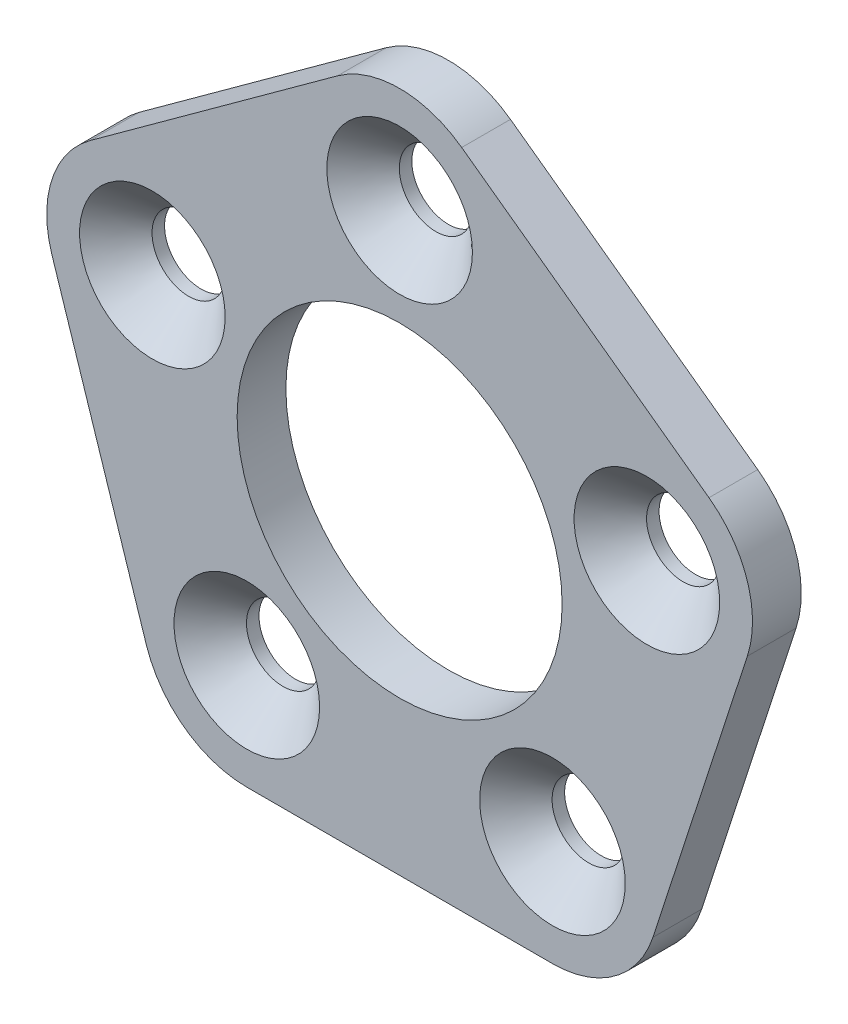
from build123d import *

# Parameters (mm, degrees)
SKETCH1_R                     = 10
BOSS_EXTRUDE1_DEPTH           = 3
CSK_FOR_M4_SFHCS1_D           = 4.5
CSK_FOR_M4_SFHCS1_DEPTH       = 5.1
CSK_FOR_M4_SFHCS1_CSINK_D     = 8.96
CSK_FOR_M4_SFHCS1_CSINK_ANGLE = 90
CSK_FOR_M4_SFHCS1_TIP         = 1.351936393


with BuildPart() as part:
    # Sketch1 → Boss-Extrude1 (new body)
    with BuildSketch(Plane.XY):
        with BuildLine():
            Line((-21.398771617, 2.935661447), (-15.586431393, -14.952882373))
            ThreePointArc((-15.586431393, -14.952882373), (-13.225168177, -18.202882373), (-9.404564037, -19.44427191))
            Line((-9.404564037, -19.44427191), (9.404564037, -19.44427191))
            ThreePointArc((9.404564037, -19.44427191), (13.225168177, -18.202882373), (15.586431393, -14.952882373))
            Line((15.586431393, -14.952882373), (21.398771617, 2.935661447))
            ThreePointArc((21.398771617, 2.935661447), (21.398771617, 6.952882373), (19.037508401, 10.202882373))
            Line((19.037508401, 10.202882373), (3.82060414, 21.258610463))
            ThreePointArc((3.82060414, 21.258610463), (0, 22.5), (-3.82060414, 21.258610463))
            Line((-3.82060414, 21.258610463), (-19.037508401, 10.202882373))
            ThreePointArc((-19.037508401, 10.202882373), (-21.398771617, 6.952882373), (-21.398771617, 2.935661447))
        make_face()
        Circle(SKETCH1_R, mode=Mode.SUBTRACT)
    extrude(amount=-BOSS_EXTRUDE1_DEPTH)

    # CSK for M4 SFHCS1
    with Locations(Plane.XY):
        with Locations((0, 16), (15.216904261, 4.94427191), (9.404564037, -12.94427191), (-9.404564037, -12.94427191), (-15.216904261, 4.94427191)):
            CounterSinkHole(CSK_FOR_M4_SFHCS1_D / 2, CSK_FOR_M4_SFHCS1_CSINK_D / 2, depth=CSK_FOR_M4_SFHCS1_DEPTH, counter_sink_angle=CSK_FOR_M4_SFHCS1_CSINK_ANGLE)
            with Locations((0, 0, -(CSK_FOR_M4_SFHCS1_DEPTH + CSK_FOR_M4_SFHCS1_TIP / 2))):  # 118° drill point
                Cone(0, CSK_FOR_M4_SFHCS1_D / 2, CSK_FOR_M4_SFHCS1_TIP, mode=Mode.SUBTRACT)


solid = part.part
